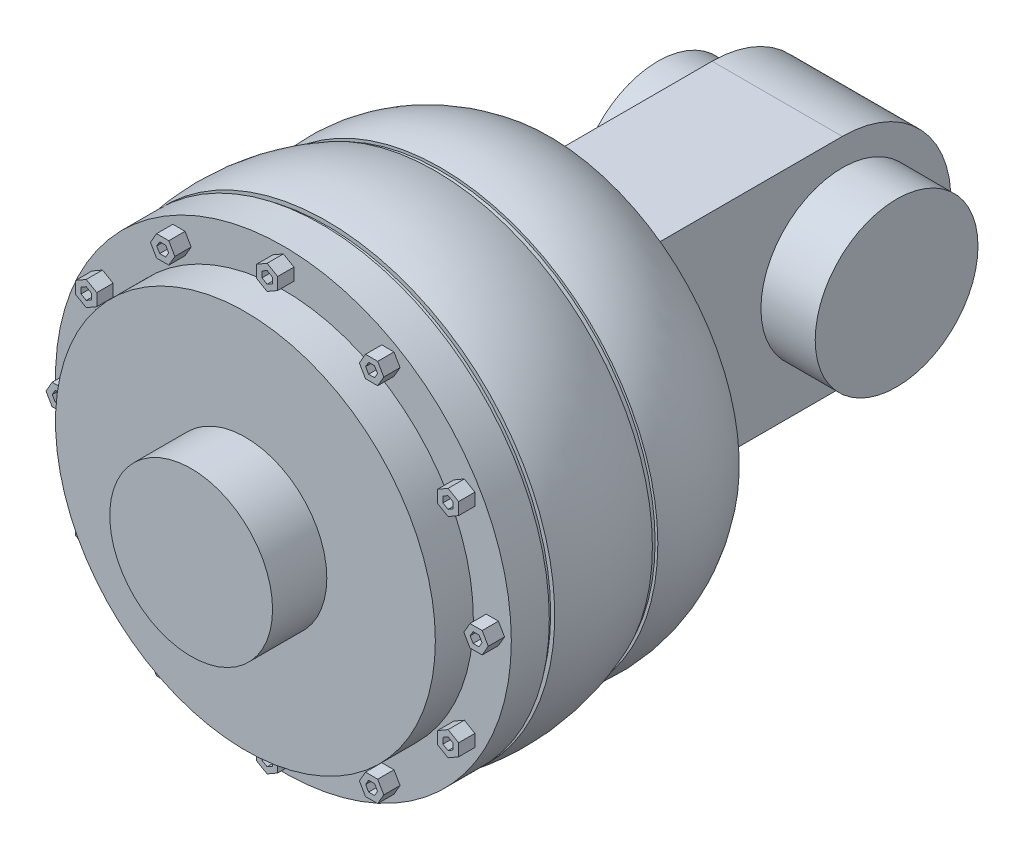
from build123d import *

# Parameters (mm, degrees)
SKETCH3_R            = 39.5
BOSS_EXTRUDE1_DEPTH  = 1
SKETCH5_R            = 41.25
BOSS_EXTRUDE2_DEPTH  = 1
SKETCH6_R            = 42
BOSS_EXTRUDE3_DEPTH  = 7
SKETCH7_R            = 35
BOSS_EXTRUDE4_DEPTH  = 7
BOSS_EXTRUDE5_DEPTH  = 3
CIRPATTERN2_COUNT    = 12
SKETCH9_R            = 15
BOSS_EXTRUDE6_DEPTH  = 10
SKETCH10_W           = 24
SKETCH10_H           = 40
BOSS_EXTRUDE7_DEPTH  = 42
BOSS_EXTRUDE8_DEPTH  = 24
SKETCH12_R           = 15
BOSS_EXTRUDE9_DEPTH  = 10
BOSS_EXTRUDE10_START = 10
SKETCH13_R           = 15
BOSS_EXTRUDE10_DEPTH = 10


with BuildPart() as part:
    # Sketch2 → Revolve1 (revolve)
    with BuildSketch(Plane(origin=(0, 0, 0), x_dir=(1, 0, 0), z_dir=(0, 1, 0))):
        with BuildLine():
            Line((-35, 0), (0, 0))
            Line((0, 0), (0, -20))
            Line((0, -20), (-40, -20))
            ThreePointArc((-40, -20), (-39.657515479, -9.46062113), (-35, 0))
        make_face()
    revolve(axis=Axis((0, 0, 0), (0, 0, 1)))

    # Sketch3 → Boss-Extrude1 (add)
    with BuildSketch(Plane.XY.offset(20)):
        Circle(SKETCH3_R)
    extrude(amount=BOSS_EXTRUDE1_DEPTH)

    # Sketch4 → Revolve2 (revolve)
    with BuildSketch(Plane(origin=(0, 0, 0), x_dir=(1, 0, 0), z_dir=(0, 1, 0))):
        with BuildLine():
            Line((-40, -21), (0, -21))
            Line((0, -21), (0, -41))
            Line((0, -41), (-42, -41))
            ThreePointArc((-42, -41), (-42.384109041, -30.861589096), (-40, -21))
        make_face()
    revolve(axis=Axis((0, 0, 21), (0, 0, 1)))

    # Sketch5 → Boss-Extrude2 (add)
    with BuildSketch(Plane.XY.offset(41)):
        Circle(SKETCH5_R)
    extrude(amount=BOSS_EXTRUDE2_DEPTH)

    # Sketch6 → Boss-Extrude3 (add)
    with BuildSketch(Plane.XY.offset(42)):
        Circle(SKETCH6_R)
    extrude(amount=BOSS_EXTRUDE3_DEPTH)

    # Sketch7 → Boss-Extrude4 (add)
    with BuildSketch(Plane.XY.offset(49)):
        Circle(SKETCH7_R)
    extrude(amount=BOSS_EXTRUDE4_DEPTH)

    # Sketch8 → Boss-Extrude5 (add)
    with BuildSketch(Plane.XY.offset(49)):
        Polygon((36.25, 0), (37.375, -1.948557159), (39.625, -1.948557159), (40.75, 0), (39.625, 1.948557159), (37.375, 1.948557159), align=None)
        Polygon((39.047649731, 0.948557159), (37.952350269, 0.948557159), (37.404700538, 0), (37.952350269, -0.948557159), (39.047649731, -0.948557159), (39.595299462, 0), align=None, mode=Mode.SUBTRACT)
    boss_extrude5 = extrude(amount=BOSS_EXTRUDE5_DEPTH)

    # CirPattern2: Boss-Extrude5 ×12 about axis
    cirpattern2_axis = Axis((0, 0, 0), (0, 0, 1))
    for i in range(1, CIRPATTERN2_COUNT):
        add(boss_extrude5.rotate(cirpattern2_axis, i * 360 / CIRPATTERN2_COUNT))

    # Sketch9 → Boss-Extrude6 (add)
    with BuildSketch(Plane.XY.offset(56)):
        Circle(SKETCH9_R)
    extrude(amount=BOSS_EXTRUDE6_DEPTH)

    # Sketch10 → Boss-Extrude7 (add)
    with BuildSketch(Plane(origin=(0, 0, 0), x_dir=(-1, 0, 0), z_dir=(0, 0, -1))):
        Rectangle(SKETCH10_W, SKETCH10_H)
    extrude(amount=BOSS_EXTRUDE7_DEPTH)

    # Sketch11 → Boss-Extrude8 (add)
    with BuildSketch(Plane(origin=(12, 0, 0), x_dir=(0, 0, -1), z_dir=(1, 0, 0))):
        with BuildLine():
            Line((42, 20), (42, -20))
            ThreePointArc((42, -20), (62, 0), (42, 20))
        make_face()
    extrude(amount=-BOSS_EXTRUDE8_DEPTH)

    # Sketch12 → Boss-Extrude9 (add)
    with BuildSketch(Plane(origin=(12, 0, 0), x_dir=(0, 0, -1), z_dir=(1, 0, 0))):
        with Locations(Location((42, 0, 0), (0, 0, 180))):
            Circle(SKETCH12_R)
    extrude(amount=BOSS_EXTRUDE9_DEPTH)

    # Sketch13 → Boss-Extrude10 (add)
    with BuildSketch(Plane.ZY.offset(12).offset(BOSS_EXTRUDE10_START)):
        with Locations((-42, 0)):
            Circle(SKETCH13_R)
    extrude(amount=-BOSS_EXTRUDE10_DEPTH)


solid = part.part
